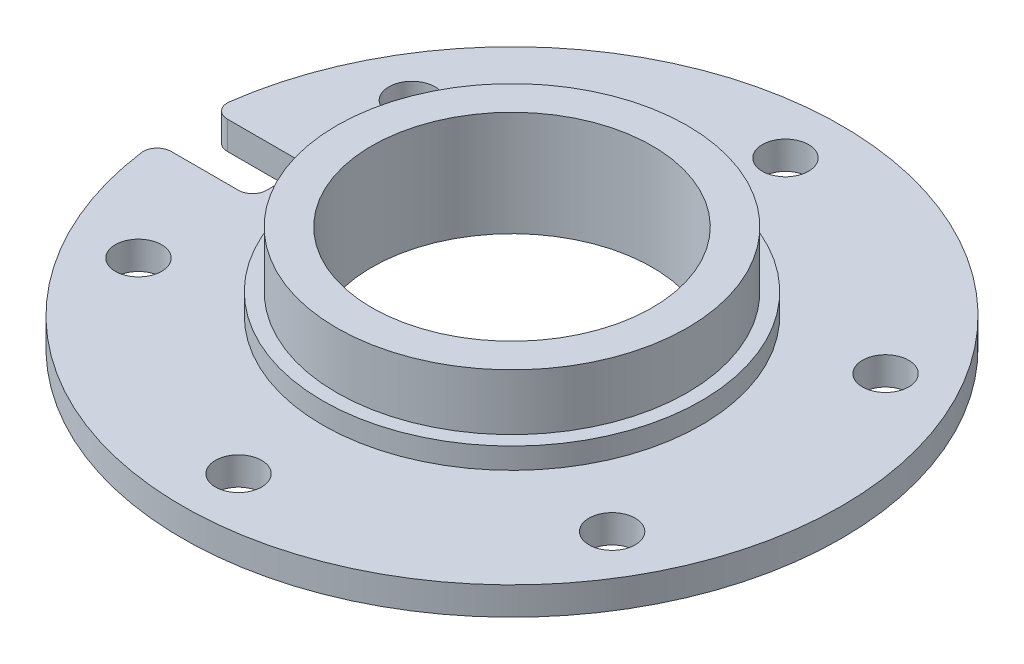
from build123d import *

# Parameters (mm, degrees)
SKETCH_1_R          = 23.5
SKETCH_1_R_2        = 10
SKETCH_1_R_3        = 1
EXTRUDE_1_DEPTH     = 2
SKETCH_2_R          = 12.5
SKETCH_2_R_2        = 10
EXTRUDE_2_DEPTH     = 5.5
SKETCH_3_R          = 13.5
SKETCH_3_R_2        = 12.5
EXTRUDE_3_DEPTH     = 1.5
SKETCH_4_W          = 7.756986748
SKETCH_4_H          = 4
CUT_EXTRUDE_1_DEPTH = 10
FILLET_1_R          = 1
HOLE_WIZARD_M4_1_D  = 3.3


with BuildPart() as part:
    # 草图1 → 凸台-拉伸1 (new body)
    with BuildSketch(Plane(origin=(0, 0, 0), x_dir=(1, 0, 0), z_dir=(0, 1, 0))):
        with Locations(Location((0, 0, 0), (0, 0, 270))):
            Circle(SKETCH_1_R)
        with Locations(Location((0, 0, 0), (0, 0, 270))):
            Circle(SKETCH_1_R_2, mode=Mode.SUBTRACT)
        with Locations(Location((0, 19.5, 0), (0, 0, 270))):
            Circle(SKETCH_1_R_3, mode=Mode.SUBTRACT)
        with Locations(Location((16.887495374, 9.75, 0), (0, 0, 270))):
            Circle(SKETCH_1_R_3, mode=Mode.SUBTRACT)
        with Locations(Location((16.887495374, -9.75, 0), (0, 0, 270))):
            Circle(SKETCH_1_R_3, mode=Mode.SUBTRACT)
        with Locations(Location((0, -19.5, 0), (0, 0, 270))):
            Circle(SKETCH_1_R_3, mode=Mode.SUBTRACT)
        with Locations(Location((-16.887495374, -9.75, 0), (0, 0, 270))):
            Circle(SKETCH_1_R_3, mode=Mode.SUBTRACT)
        with Locations(Location((-16.887495374, 9.75, 0), (0, 0, 270))):
            Circle(SKETCH_1_R_3, mode=Mode.SUBTRACT)
    extrude(amount=EXTRUDE_1_DEPTH)

    # 草图2 → 凸台-拉伸2 (add)
    with BuildSketch(Plane(origin=(0, 2, 0), x_dir=(1, 0, 0), z_dir=(0, 1, 0))):
        with Locations(Location((0, 0, 0), (0, 0, 270))):
            Circle(SKETCH_2_R)
        with Locations(Location((0, 0, 0), (0, 0, 270))):
            Circle(SKETCH_2_R_2, mode=Mode.SUBTRACT)
    extrude(amount=EXTRUDE_2_DEPTH)

    # 草图3 → 凸台-拉伸3 (add)
    with BuildSketch(Plane(origin=(0, 2, 0), x_dir=(1, 0, 0), z_dir=(0, 1, 0))):
        with Locations(Location((0, 0, 0), (0, 0, 270))):
            Circle(SKETCH_3_R)
        with Locations(Location((0, 0, 0), (0, 0, 270))):
            Circle(SKETCH_3_R_2, mode=Mode.SUBTRACT)
    extrude(amount=EXTRUDE_3_DEPTH)

    # 草图4 → 切除-拉伸1 (cut)
    with BuildSketch(Plane.XZ):
        with Locations((-20.378493374, 0)):
            Rectangle(SKETCH_4_W, SKETCH_4_H)
    extrude(amount=-CUT_EXTRUDE_1_DEPTH, mode=Mode.SUBTRACT)

    # 圆角1
    fillet_1_edges = [part.edges().sort_by_distance(p)[0] for p in [
        (-23.414738948, 1, -2),
        (-23.414738948, 1, 2),
        (-16.5, 1, 2),
        (-16.5, 1, -2),
    ]]
    fillet(fillet_1_edges, radius=FILLET_1_R)

    # M4 螺纹孔1 (through all)
    with Locations(Plane(origin=(0, 0, 0), x_dir=(-1, 0, 0), z_dir=(0, -1, 0))):
        with Locations((0, 19.5), (-16.887495374, 9.75), (-16.887495374, -9.75), (0, -19.5), (16.887495374, -9.75), (16.887495374, 9.75)):
            Hole(HOLE_WIZARD_M4_1_D / 2)


solid = part.part
